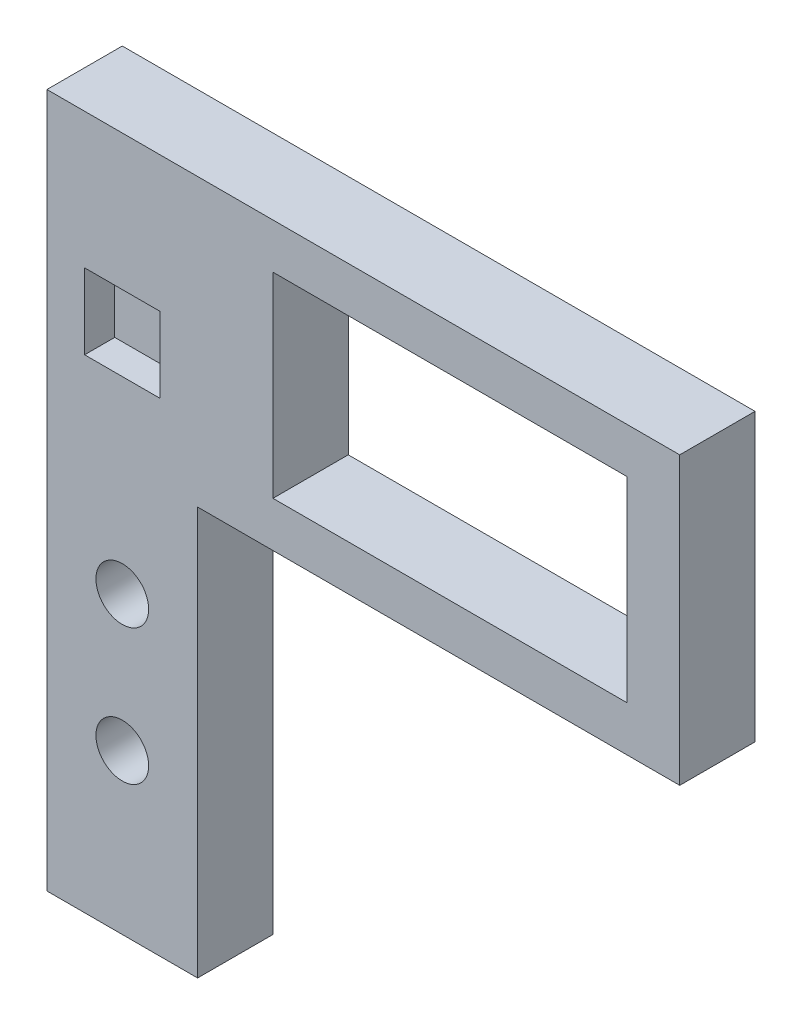
from build123d import *

# Parameters (mm, degrees)
SKIZZE1_W                       = 10
SKIZZE1_H                       = 46.07297751
SKIZZE1_R                       = 1.75
SKIZZE1_W_2                     = 3.5
SKIZZE1_H_2                     = 13
AUFSATZ_LINEAR_AUSTRAGEN1_DEPTH = 5
SKIZZE2_W                       = 5
SKIZZE2_H                       = 5
SCHNITT_LINEAR_AUSTRAGEN2_DEPTH = 2


with BuildPart() as part:
    # Skizze1 → Aufsatz-Linear austragen1 (new body)
    # profile 1 of 5: a face of its own
    with BuildSketch(Plane.XY):
        with Locations((0, 10.889252833)):
            Rectangle(SKIZZE1_W, SKIZZE1_H)
        with Locations((0, -1.574258412)):
            Circle(SKIZZE1_R, mode=Mode.SUBTRACT)
        with Locations((0, 7.425741588)):
            Circle(SKIZZE1_R, mode=Mode.SUBTRACT)
    # profile 2 of 5: a face of its own
    with BuildSketch(Plane.XY):
        Polygon((10, 30.925741588), (5, 30.925741588), (5, 30.675741588), (5, 18.175741588), (5, 17.925741588), (10, 17.925741588), align=None)
    # profile 3 of 5: a face of its own
    with BuildSketch(Plane.XY):
        Polygon((33.5, 17.925741588), (10, 17.925741588), (5, 17.925741588), (5, 14.925741588), (37, 14.925741588), (37, 17.925741588), align=None)
    # profile 4 of 5: a face of its own
    with BuildSketch(Plane.XY):
        Polygon((37, 33.925741588), (5, 33.925741588), (5, 30.925741588), (10, 30.925741588), (33.5, 30.925741588), (37, 30.925741588), align=None)
    # profile 5 of 5: a face of its own
    with BuildSketch(Plane.XY):
        with Locations((35.25, 24.425741588)):
            Rectangle(SKIZZE1_W_2, SKIZZE1_H_2)
    extrude(amount=AUFSATZ_LINEAR_AUSTRAGEN1_DEPTH)

    # Skizze2 → Schnitt-Linear austragen2 (cut)
    with BuildSketch(Plane(origin=(0, 0, 5), x_dir=(-1, 0, 0), z_dir=(0, 0, -1))):
        with Locations((0, 22.425741588)):
            Rectangle(SKIZZE2_W, SKIZZE2_H)
    extrude(amount=SCHNITT_LINEAR_AUSTRAGEN2_DEPTH, mode=Mode.SUBTRACT)


solid = part.part
